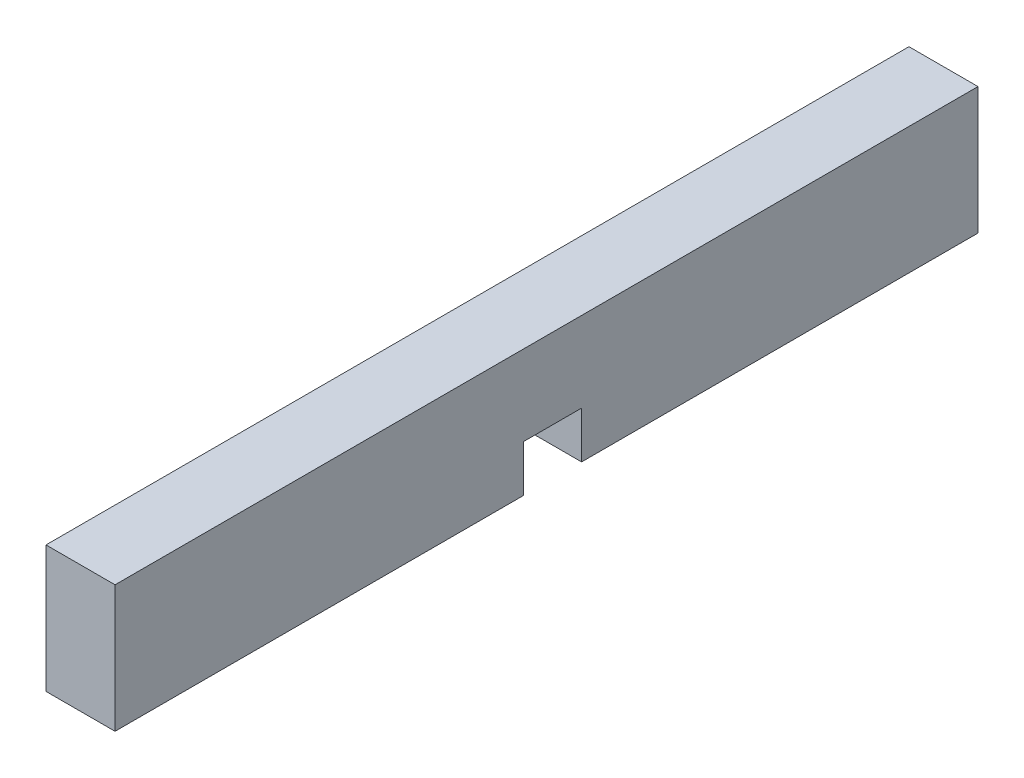
from build123d import *

# Parameters (mm, degrees)
SKETCH2_W               = 58.7248
SKETCH2_H               = 8.636
BOSS_EXTRUDE1_DEPTH     = 2.3495
CUT_EXTRUDE1_DEPTH      = 31.047899407
CUT_EXTRUDE1_DEPTH_BACK = 31.047899407
SKETCH3_W               = 3.9624
SKETCH3_H               = 3.175


with BuildPart() as part:
    # Sketch2 → Boss-Extrude1 (new, symmetric)
    with BuildSketch(Plane(origin=(0, 0, 0), x_dir=(0, 0, -1), z_dir=(1, 0, 0))):
        Rectangle(SKETCH2_W, SKETCH2_H)
    extrude(amount=BOSS_EXTRUDE1_DEPTH, both=True)

    # Sketch3 → Cut-Extrude1 (cut, two sides: drawn at the far end of the back side and taken through both)
    with BuildSketch(Plane(origin=(2.3495, 0, 0), x_dir=(0, 0, -1), z_dir=(1, 0, 0)).offset(-CUT_EXTRUDE1_DEPTH_BACK)):
        with Locations((0.4064, -2.7305)):
            Rectangle(SKETCH3_W, SKETCH3_H)
    extrude(amount=CUT_EXTRUDE1_DEPTH + CUT_EXTRUDE1_DEPTH_BACK, mode=Mode.SUBTRACT)


solid = part.part
